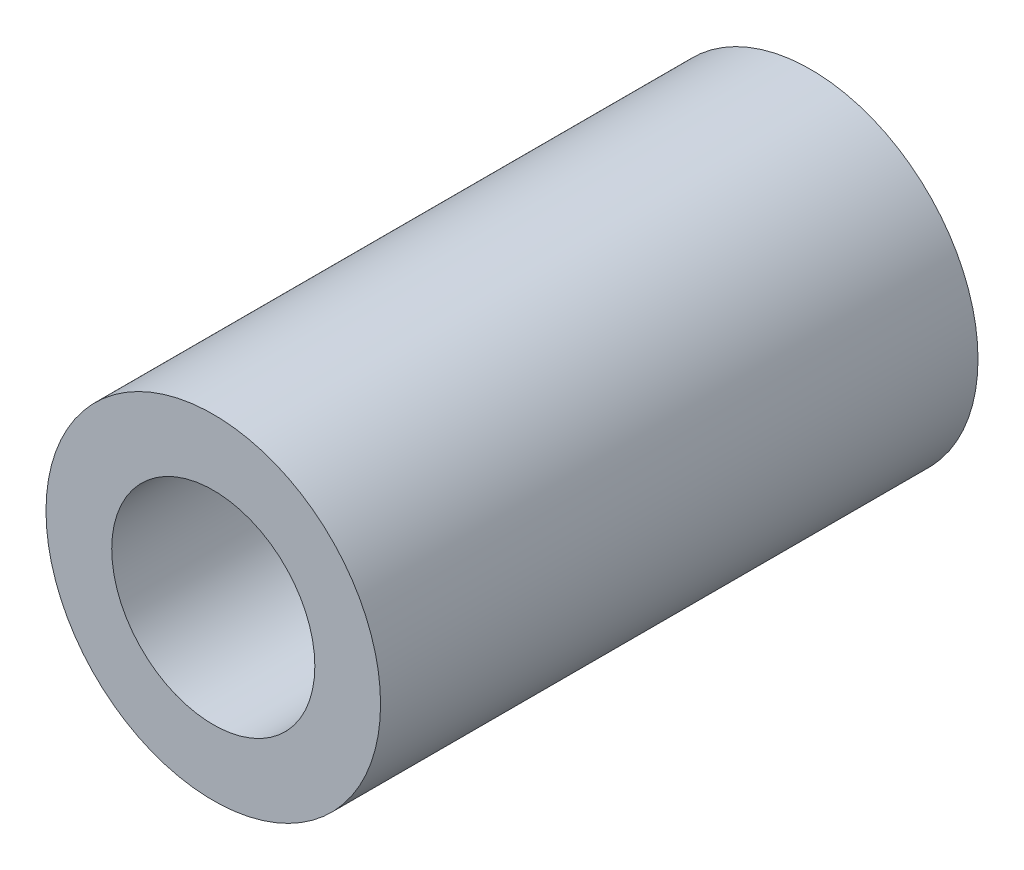
from build123d import *

# Parameters (mm, degrees)
SKETCH1_R           = 7
SKETCH1_R_2         = 4.25
BOSS_EXTRUDE1_DEPTH = 25


with BuildPart() as part:
    # Sketch1 → Boss-Extrude1 (new body)
    with BuildSketch(Plane.XY):
        Circle(SKETCH1_R)
        Circle(SKETCH1_R_2, mode=Mode.SUBTRACT)
    extrude(amount=BOSS_EXTRUDE1_DEPTH)


solid = part.part
